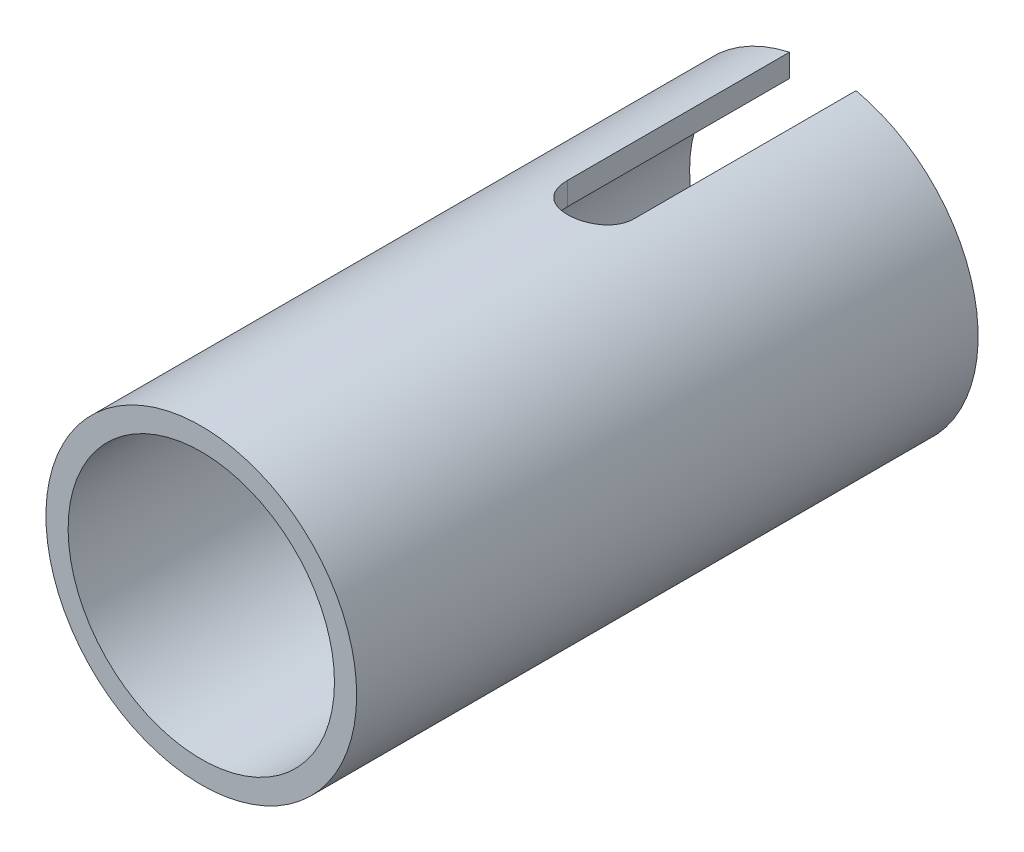
from build123d import *

# Parameters (mm, degrees)
ESQUISSE1_R             = 7
ESQUISSE1_R_2           = 6
BOSS_EXTRU_1_DEPTH      = 14
ENL_V_MAT_EXTRU_1_DEPTH = 18.146428199


with BuildPart() as part:
    # Esquisse1 → Boss.-Extru.1 (new, symmetric)
    with BuildSketch(Plane.XY):
        Circle(ESQUISSE1_R)
        Circle(ESQUISSE1_R_2, mode=Mode.SUBTRACT)
    extrude(amount=BOSS_EXTRU_1_DEPTH, both=True)

    # Esquisse2 → Enlèv. mat.-Extru.1 (cut, through all)
    with BuildSketch(Plane(origin=(0, 0, 0), x_dir=(1, 0, 0), z_dir=(0, 1, 0))):
        with BuildLine():
            Line((-1.5, 82.523499554), (-1.5, 14))
            Line((-1.5, 14), (-1.5, 4))
            ThreePointArc((-1.5, 4), (0, 2.5), (1.5, 4))
            Line((1.5, 4), (1.5, 14))
            Line((1.5, 14), (1.5, 82.523499554))
            Line((1.5, 82.523499554), (1.5, 219.570498661))
            Line((1.5, 219.570498661), (-1.5, 219.570498661))
            Line((-1.5, 219.570498661), (-1.5, 82.523499554))
        make_face()
    extrude(amount=ENL_V_MAT_EXTRU_1_DEPTH, mode=Mode.SUBTRACT)


solid = part.part
